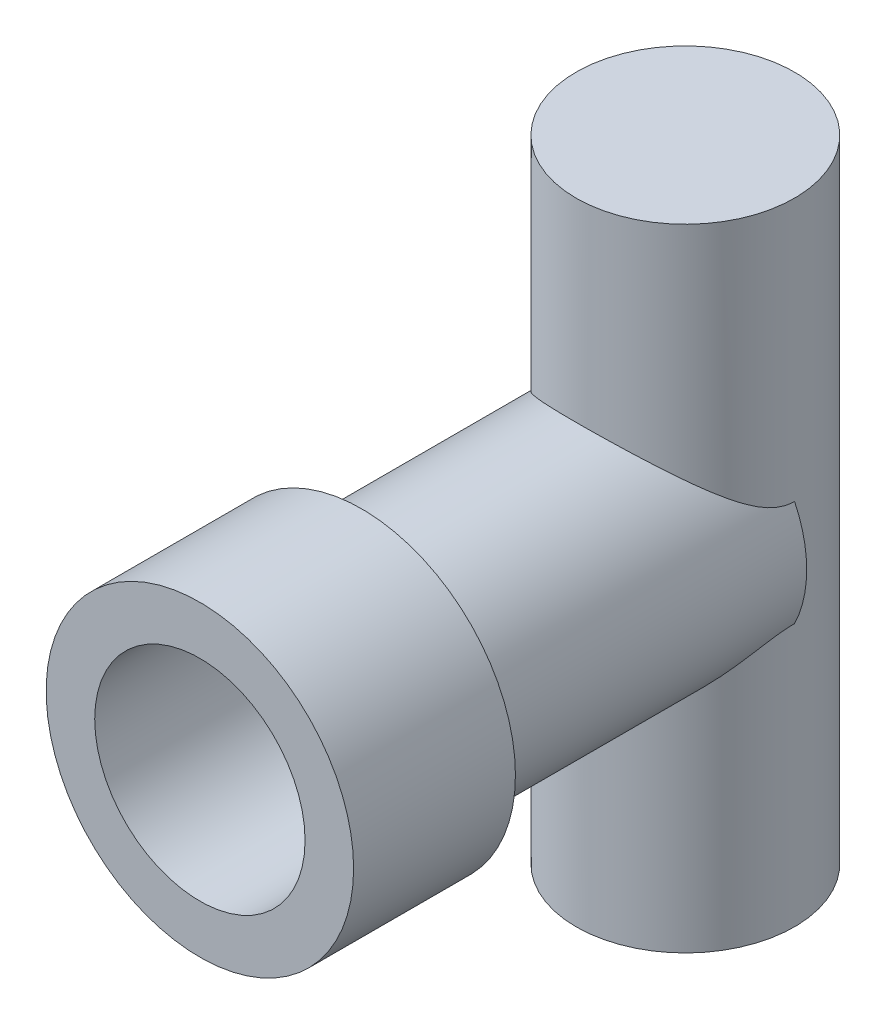
from build123d import *

# Parameters (mm, degrees)
SKETCH_1_R           = 30
SKETCH_1_R_2         = 26
EXTRUDE_1_DEPTH      = 120
SKETCH_2_R           = 38
SKETCH_2_R_2         = 30
EXTRUDE_2_DEPTH      = 40
EXTRUDE_3_DEPTH      = 78
EXTRUDE_3_DEPTH_BACK = 78
SKETCH_3_R           = 27


with BuildPart() as part:
    # 草图1 → 凸台-拉伸1 (new body)
    with BuildSketch(Plane.XY):
        Circle(SKETCH_1_R)
        Circle(SKETCH_1_R_2, mode=Mode.SUBTRACT)
    extrude(amount=-EXTRUDE_1_DEPTH)

    # 草图2 → 凸台-拉伸2 (add)
    with BuildSketch(Plane.XY):
        Circle(SKETCH_2_R)
        Circle(SKETCH_2_R_2, mode=Mode.SUBTRACT)
    extrude(amount=-EXTRUDE_2_DEPTH)

    # 草图3 → 凸台-拉伸3 (add, two sides: drawn at the far end of the back side and taken through both)
    with BuildSketch(Plane(origin=(0, 0, 0), x_dir=(1, 0, 0), z_dir=(0, 1, 0)).offset(-EXTRUDE_3_DEPTH_BACK)):
        with Locations((0, 120)):
            Circle(SKETCH_3_R)
    extrude(amount=EXTRUDE_3_DEPTH + EXTRUDE_3_DEPTH_BACK)


solid = part.part
